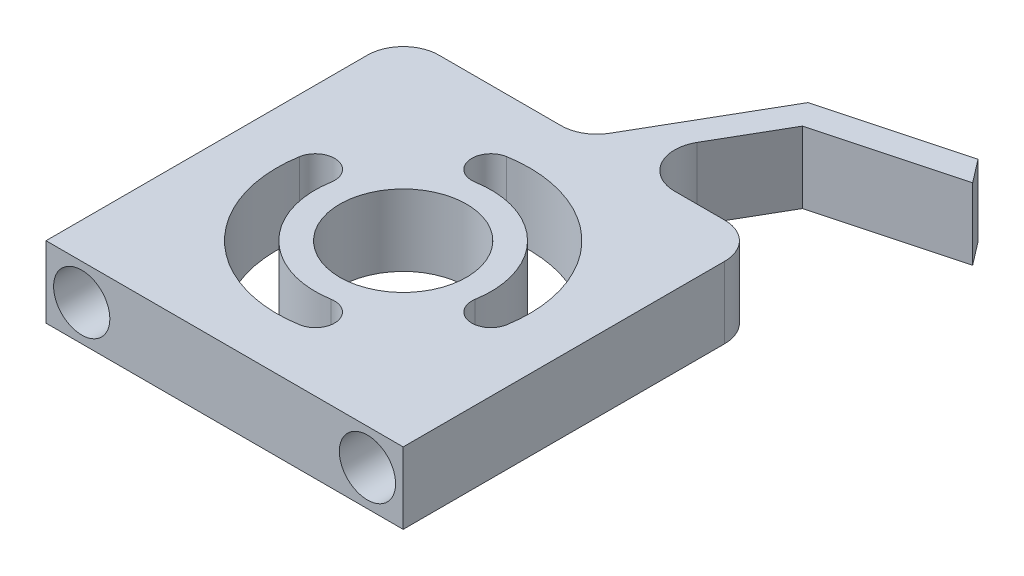
from build123d import *

# Parameters (mm, degrees)
SKETCH1_W           = 40
SKETCH1_H           = 40
SKETCH1_R           = 7.1
BOSS_EXTRUDE1_DEPTH = 8
FILLET1_R           = 4
SKETCH2_R           = 3.15
CUT_EXTRUDE1_DEPTH  = 4.7
BOSS_EXTRUDE2_DEPTH = 8
FILLET2_R           = 4


with BuildPart() as part:
    # Sketch1 → Boss-Extrude1 (new body)
    with BuildSketch(Plane(origin=(0, 0, 0), x_dir=(1, 0, 0), z_dir=(0, 1, 0))):
        Rectangle(SKETCH1_W, SKETCH1_H)
        with Locations(Location((0, 0, 0), (0, 0, 270))):
            Circle(SKETCH1_R, mode=Mode.SUBTRACT)
        with BuildLine():
            ThreePointArc((-1.641666667, 9.712230977), (6.965001795, 6.965001795), (9.712230977, -1.641666667))
            ThreePointArc((9.712230977, -1.641666667), (11.473826233, -4.119928589), (13.952088155, -2.358333333))
            ThreePointArc((13.952088155, -2.358333333), (10.005560954, 10.005560954), (-2.358333333, 13.952088155))
            ThreePointArc((-2.358333333, 13.952088155), (-4.119928589, 11.473826233), (-1.641666667, 9.712230977))
        make_face(mode=Mode.SUBTRACT)
        with BuildLine():
            ThreePointArc((-13.952088155, 2.358333333), (-10.005560954, -10.005560954), (2.358333333, -13.952088155))
            ThreePointArc((2.358333333, -13.952088155), (4.119928589, -11.473826233), (1.641666667, -9.712230977))
            ThreePointArc((1.641666667, -9.712230977), (-6.965001795, -6.965001795), (-9.712230977, 1.641666667))
            ThreePointArc((-9.712230977, 1.641666667), (-11.473826233, 4.119928589), (-13.952088155, 2.358333333))
        make_face(mode=Mode.SUBTRACT)
    extrude(amount=BOSS_EXTRUDE1_DEPTH)

    # Fillet1
    fillet1_edges = [part.edges().sort_by_distance(p)[0] for p in [
        (-20, 4, -20),
        (20, 4, -20),
    ]]
    fillet(fillet1_edges, radius=FILLET1_R)

    # Sketch2 → Cut-Extrude1 (cut)
    with BuildSketch(Plane.XY.offset(20)):
        with Locations((-16, 4)):
            Circle(SKETCH2_R)
        with Locations((16, 4)):
            Circle(SKETCH2_R)
    extrude(amount=-CUT_EXTRUDE1_DEPTH, mode=Mode.SUBTRACT)

    # Sketch3 → Boss-Extrude2 (add)
    with BuildSketch(Plane(origin=(0, 8, 0), x_dir=(1, 0, 0), z_dir=(0, 1, 0))):
        Polygon((0, 20), (9.266942717, 36.050815617), (24.295969979, 40.077831335), (26.272725847, 37.501672932), (11.243698585, 33.474657214), (3.464101615, 20), align=None)
    extrude(amount=-BOSS_EXTRUDE2_DEPTH)

    # Fillet2
    fillet2_edges = [part.edges().sort_by_distance(p)[0] for p in [
        (3.464101615, 4, -20),
        (0, 4, -20),
    ]]
    fillet(fillet2_edges, radius=FILLET2_R)


solid = part.part
